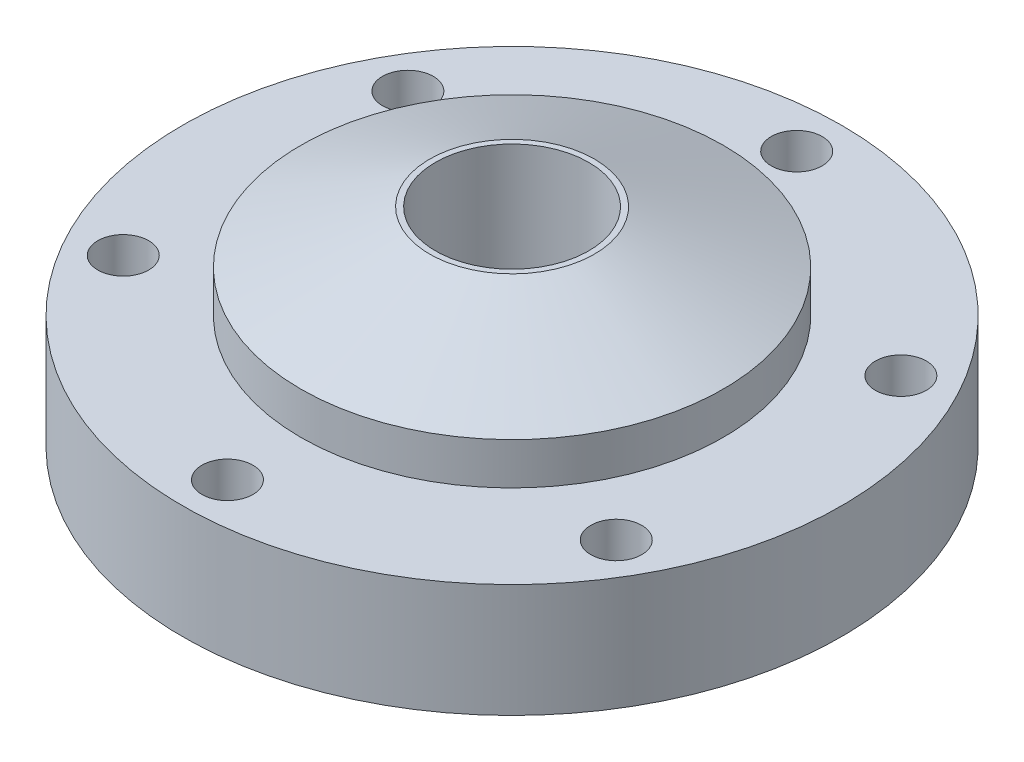
from build123d import *

# Parameters (mm, degrees)
M3_CLEARANCE_HOLE1_D     = 3.4
M3_CLEARANCE_HOLE1_DEPTH = 7.5673


with BuildPart() as part:
    # Sketch1 → Revolve1 (revolve)
    with BuildSketch(Plane.XY, mode=Mode.PRIVATE) as revolve1_sk:
        Polygon((5.12, 5), (5.12, 13.8632), (5.5, 13.8632), (14.1, 10.3613), (14.1, 7.5673), (22, 7.5673), (22, 0), (6.75, 0), (6.75, 5), align=None)
    revolve(revolve1_sk.sketch.rotate(Axis((0, 0, 0), (0, 1, 0)), 90), axis=Axis((0, 0, 0), (0, 1, 0)))

    # M3 Clearance Hole1
    with Locations(Plane(origin=(0, 7.5673, 0), x_dir=(1, 0, 0), z_dir=(0, 1, 0))):
        with Locations((0, 19), (16.454482672, 9.5), (16.454482672, -9.5), (0, -19), (-16.454482672, -9.5), (-16.454482672, 9.5), (0, 0)):
            Hole(M3_CLEARANCE_HOLE1_D / 2, depth=M3_CLEARANCE_HOLE1_DEPTH)


solid = part.part
